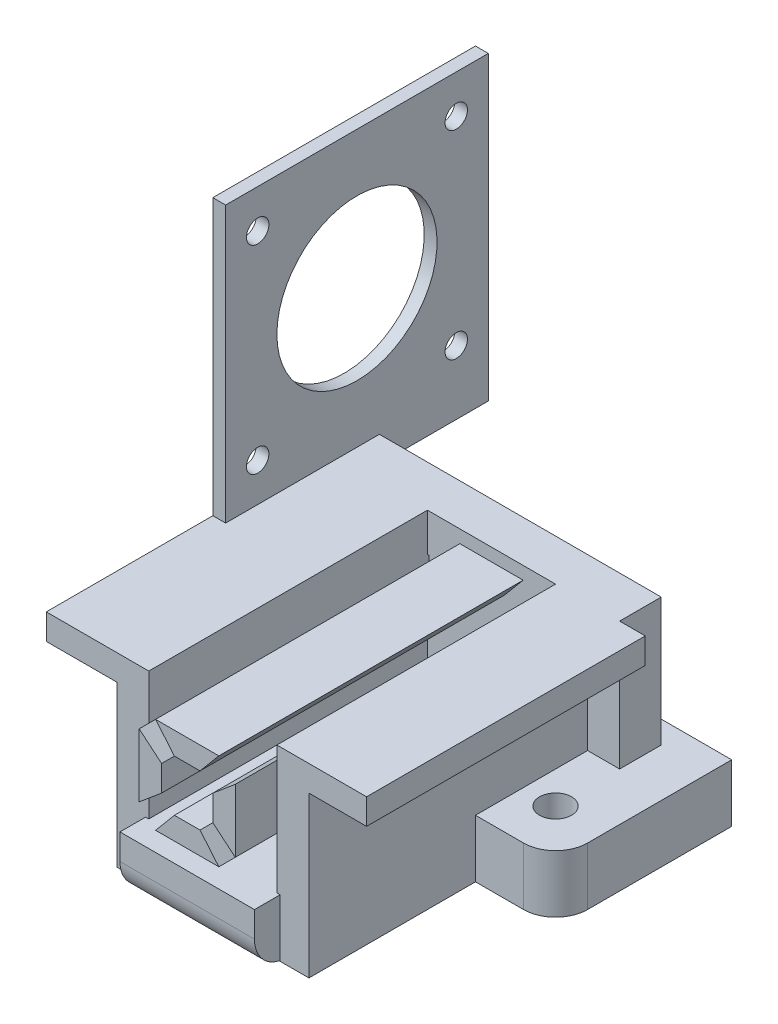
from build123d import *

# Parameters (mm, degrees)
BOSS_EXTRUDE2_DEPTH          = 8
BOSS_EXTRUDE2_DEPTH_BACK     = 1
SKETCH1_R                    = 2.5
CUT_EXTRUDE1_DEPTH           = 79.300702423
CUT_EXTRUDE1_DEPTH_BACK      = 79.300702423
SKETCH2_R                    = 2.5
SKETCH3_R                    = 3.25
CUT_EXTRUDE5_DEPTH           = 15
CUT_EXTRUDE5_DRAFT           = -0.0573
CUT_EXTRUDE5_PROFILE_2_DEPTH = 15
CUT_EXTRUDE5_PROFILE_2_DRAFT = -0.0573
SKETCH5_W                    = 9
SKETCH5_H                    = 6.5
BOSS_EXTRUDE3_DEPTH          = 14.5
CUT_EXTRUDE4_DEPTH           = 1.5
SKETCH12_W                   = 21
SKETCH12_H                   = 30
BOSS_EXTRUDE7_DEPTH          = 9
SKETCH15_W                   = 9
SKETCH15_H                   = 6.5
BOSS_EXTRUDE8_DEPTH          = 3.5
BOSS_EXTRUDE9_DEPTH          = 54
FILLET4_R                    = 5
SKETCH18_W                   = 9.873697418
SKETCH18_H                   = 6.5
BOSS_EXTRUDE11_DEPTH         = 0.5
SKETCH20_W                   = 4
SKETCH20_H                   = 17.5
BOSS_EXTRUDE12_DEPTH         = 18
BOSS_EXTRUDE13_DEPTH         = 11
BOSS_EXTRUDE13_DEPTH_BACK    = 4
SKETCH22_W                   = 17.5
SKETCH22_H                   = 4
SKETCH25_W                   = 2
SKETCH25_H                   = 17.5
BOSS_EXTRUDE14_DEPTH         = 41
SKETCH28_W                   = 41
SKETCH28_H                   = 45
BOSS_EXTRUDE15_DEPTH         = 2
SKETCH29_R                   = 1.75
CUT_EXTRUDE8_DEPTH           = 9
BOSS_EXTRUDE16_DEPTH         = 9
BOSS_EXTRUDE16_DEPTH_BACK    = 4
SKETCH30_W                   = 17.5
SKETCH30_H                   = 4
SKETCH31_R                   = 10
CUT_EXTRUDE9_DEPTH           = 9
SKETCH32_W                   = 13
SKETCH32_H                   = 4
BOSS_EXTRUDE17_DEPTH         = 23.5
SKETCH33_W                   = 0.5
SKETCH33_H                   = 17.5
BOSS_EXTRUDE18_DEPTH         = 20
BOSS_EXTRUDE19_DEPTH         = 26
SKETCH35_W                   = 9.873697418
SKETCH35_H                   = 0.5
BOSS_EXTRUDE20_DEPTH         = 47.5
BOSS_EXTRUDE21_DEPTH         = 47.5
SKETCH38_W                   = 0.419549816
SKETCH38_H                   = 18.5
CUT_EXTRUDE10_DEPTH          = 90.5
BOSS_EXTRUDE23_DEPTH         = 47.5
SKETCH46_W                   = 27.5
SKETCH46_H                   = 9
BOSS_EXTRUDE26_DEPTH         = 11.5
SKETCH47_W                   = 27.5
SKETCH47_H                   = 9
BOSS_EXTRUDE27_DEPTH         = 11
SKETCH48_W                   = 15.5
SKETCH48_H                   = 6.5
BOSS_EXTRUDE31_DEPTH         = 18.5
SKETCH50_R                   = 4
CUT_EXTRUDE11_DEPTH          = 1.5
SKETCH51_W                   = 9.626242636
SKETCH51_H                   = 9.125298808
BOSS_EXTRUDE32_DEPTH         = 1.5
SKETCH54_W                   = 8
SKETCH54_H                   = 8
BOSS_EXTRUDE35_DEPTH         = 47.5
SKETCH55_W                   = 9.873697418
SKETCH55_H                   = 0.5
CUT_EXTRUDE12_DEPTH          = 47.5
SKETCH56_W                   = 0.5
SKETCH56_H                   = 20
BOSS_EXTRUDE36_DEPTH         = 43.5
BOSS_EXTRUDE37_DEPTH         = 47.5
SKETCH58_W                   = 0.715052156
SKETCH58_H                   = 9.51279705
CUT_EXTRUDE13_DEPTH          = 4
CUT_EXTRUDE15_DEPTH          = 47.5
SKETCH60_W                   = 0.215052156
SKETCH60_H                   = 9.51279705
CUT_EXTRUDE16_DEPTH          = 47.5
CUT_EXTRUDE17_DEPTH          = 47.5
SKETCH62_W                   = 8
SKETCH62_H                   = 8
CUT_EXTRUDE18_DEPTH          = 47.5
SKETCH63_W                   = 13
SKETCH63_H                   = 4
CUT_EXTRUDE20_DEPTH          = 17
SKETCH64_W                   = 1
SKETCH64_H                   = 1.5
BOSS_EXTRUDE38_DEPTH         = 6.5
SKETCH65_W                   = 7
SKETCH65_H                   = 3
CUT_EXTRUDE21_DEPTH          = 1.5
BOSS_EXTRUDE39_START         = -2
SKETCH66_R                   = 10
BOSS_EXTRUDE39_DEPTH         = 2
SKETCH67_R                   = 12.5
CUT_EXTRUDE22_DEPTH          = 155
BOSS_EXTRUDE40_DEPTH         = 1.5
SKETCH70_W                   = 2
SKETCH70_H                   = 41
BOSS_EXTRUDE41_DEPTH         = 2


with BuildPart() as part:
    # Sketch1 → Boss-Extrude2 (new, two sides: drawn at the far end of the back side and taken through both)
    with BuildSketch(Plane(origin=(0, 0, 0), x_dir=(1, 0, 0), z_dir=(0, 1, 0)).offset(-BOSS_EXTRUDE2_DEPTH_BACK)):
        with BuildLine():
            Line((5, 0), (50, 0))
            ThreePointArc((50, 0), (53.535533906, 1.464466094), (55, 5))
            Line((55, 5), (55, 50))
            ThreePointArc((55, 50), (53.535533906, 53.535533906), (50, 55))
            Line((50, 55), (5, 55))
            ThreePointArc((5, 55), (1.464466094, 53.535533906), (0, 50))
            Line((0, 50), (0, 5))
            ThreePointArc((0, 5), (1.464466094, 1.464466094), (5, 0))
        make_face()
        with Locations((7.5, 47.5)):
            Circle(SKETCH1_R, mode=Mode.SUBTRACT)
        with Locations((47.5, 47.5)):
            Circle(SKETCH1_R, mode=Mode.SUBTRACT)
        with Locations((47.5, 7.5)):
            Circle(SKETCH1_R, mode=Mode.SUBTRACT)
        with Locations((7.5, 7.5)):
            Circle(SKETCH1_R, mode=Mode.SUBTRACT)
    extrude(amount=BOSS_EXTRUDE2_DEPTH + BOSS_EXTRUDE2_DEPTH_BACK)

    # Sketch2 → Cut-Extrude1 (cut, two sides: drawn at the far end of the back side and taken through both)
    with BuildSketch(Plane(origin=(0, 8, 0), x_dir=(1, 0, 0), z_dir=(0, 1, 0)).offset(-CUT_EXTRUDE1_DEPTH_BACK)):
        with BuildLine():
            Line((0, 50), (0, 27.5))
            Line((0, 27.5), (55, 27.5))
            Line((55, 27.5), (55, 50))
            ThreePointArc((55, 50), (53.535533906, 53.535533906), (50, 55))
            Line((50, 55), (5, 55))
            ThreePointArc((5, 55), (1.464466094, 53.535533906), (0, 50))
        make_face()
        with Locations((7.5, 47.5)):
            Circle(SKETCH2_R, mode=Mode.SUBTRACT)
        with Locations((47.5, 47.5)):
            Circle(SKETCH2_R, mode=Mode.SUBTRACT)
    extrude(amount=CUT_EXTRUDE1_DEPTH + CUT_EXTRUDE1_DEPTH_BACK, mode=Mode.SUBTRACT)


with BuildPart() as cut_extrude5_tool:
    # Sketch3 → Cut-Extrude5 (with draft: the straight prism first)
    with BuildSketch(Plane(origin=(0, 0, -27.5), x_dir=(-1, 0, 0), z_dir=(0, 0, -1))):
        with Locations((-37.5, 3.5)):
            Circle(SKETCH3_R)
    extrude(amount=-CUT_EXTRUDE5_DEPTH)
    # Cut-Extrude5: the draft: its side faces are tilted about the plane it starts from
    cut_extrude5_sides = [cut_extrude5_tool.faces().sort_by_distance(p)[0] for p in [
        (40.75, 3.5, -20),
    ]]
    draft(cut_extrude5_sides, Plane(origin=(0, 0, -27.5), x_dir=(-1, 0, 0), z_dir=(0, 0, -1)), CUT_EXTRUDE5_DRAFT)


with BuildPart() as part_1:
    add(part.part)

    # Cut-Extrude5: cut by cut_extrude5_tool
    add(cut_extrude5_tool.part, mode=Mode.SUBTRACT)


with BuildPart() as cut_extrude5_profile_2_tool:
    # Sketch3 → Cut-Extrude5 profile 2 (with draft: the straight prism first)
    with BuildSketch(Plane(origin=(0, 0, -27.5), x_dir=(-1, 0, 0), z_dir=(0, 0, -1))):
        with Locations((-17.5, 3.5)):
            Circle(SKETCH3_R)
    extrude(amount=-CUT_EXTRUDE5_PROFILE_2_DEPTH)
    # Cut-Extrude5 profile 2: the draft: its side faces are tilted about the plane it starts from
    cut_extrude5_profile_2_sides = [cut_extrude5_profile_2_tool.faces().sort_by_distance(p)[0] for p in [
        (20.75, 3.5, -20),
    ]]
    draft(cut_extrude5_profile_2_sides, Plane(origin=(0, 0, -27.5), x_dir=(-1, 0, 0), z_dir=(0, 0, -1)), CUT_EXTRUDE5_PROFILE_2_DRAFT)


with BuildPart() as part_2:
    add(part_1.part)

    # Cut-Extrude5 profile 2: cut by cut_extrude5_profile_2_tool
    add(cut_extrude5_profile_2_tool.part, mode=Mode.SUBTRACT)

    # Sketch5 → Boss-Extrude3 (add)
    with BuildSketch(Plane(origin=(0, 8, 0), x_dir=(1, 0, 0), z_dir=(0, 1, 0))):
        with Locations((27.5, 20.75)):
            Rectangle(SKETCH5_W, SKETCH5_H)
    extrude(amount=BOSS_EXTRUDE3_DEPTH)

    # Sketch6 → Cut-Extrude4 (cut)
    with BuildSketch(Plane(origin=(0, 0, -24), x_dir=(-1, 0, 0), z_dir=(0, 0, -1))):
        with BuildLine():
            ThreePointArc((-27.5, 13), (-24.671572875, 14.171572875), (-23.5, 17))
            ThreePointArc((-23.5, 17), (-30.328427125, 19.828427125), (-27.5, 13))
        make_face()
    extrude(amount=-CUT_EXTRUDE4_DEPTH, mode=Mode.SUBTRACT)

    # Sketch12 → Boss-Extrude7 (add)
    with BuildSketch(Plane(origin=(0, 8, 0), x_dir=(1, 0, 0), z_dir=(0, 1, 0))):
        with Locations((27.5, -15)):
            Rectangle(SKETCH12_W, SKETCH12_H)
    extrude(amount=-BOSS_EXTRUDE7_DEPTH)

    # Sketch15 → Boss-Extrude8 (add)
    with BuildSketch(Plane(origin=(0, 22.5, 0), x_dir=(1, 0, 0), z_dir=(0, 1, 0))):
        with Locations((27.5, 20.75)):
            Rectangle(SKETCH15_W, SKETCH15_H)
    extrude(amount=BOSS_EXTRUDE8_DEPTH)

    # Sketch11 → Boss-Extrude9 (add)
    with BuildSketch(Plane(origin=(0, 0, -24), x_dir=(-1, 0, 0), z_dir=(0, 0, -1))):
        Polygon((-29.5, 22.5), (-25.5, 22.5), (-22.563151291, 26), (-32.436848709, 26), align=None)
    extrude(amount=-BOSS_EXTRUDE9_DEPTH)

    # Fillet4
    fillet4_edges = [part_2.edges().sort_by_distance(p)[0] for p in [
        (27.5, -1, 30),
    ]]
    fillet(fillet4_edges, radius=FILLET4_R)

    # Sketch18 → Boss-Extrude11 (add)
    with BuildSketch(Plane(origin=(0, 26, 0), x_dir=(1, 0, 0), z_dir=(0, 1, 0))):
        with Locations((27.5, 20.75)):
            Rectangle(SKETCH18_W, SKETCH18_H)
    extrude(amount=BOSS_EXTRUDE11_DEPTH)

    # Sketch20 → Boss-Extrude12 (add)
    with BuildSketch(Plane(origin=(0, 8, 0), x_dir=(1, 0, 0), z_dir=(0, 1, 0))):
        with Locations((14.5, 8.75)):
            Rectangle(SKETCH20_W, SKETCH20_H)
        with Locations((40.5, 8.75)):
            Rectangle(SKETCH20_W, SKETCH20_H)
    extrude(amount=BOSS_EXTRUDE12_DEPTH)

    # Sketch22 → Boss-Extrude13 (add, two sides: drawn at the far end of the back side and taken through both)
    with BuildSketch(Plane.ZY.offset(-12.5).offset(-BOSS_EXTRUDE13_DEPTH_BACK)):
        with Locations((-8.75, 26)):
            Rectangle(SKETCH22_W, SKETCH22_H)
    extrude(amount=BOSS_EXTRUDE13_DEPTH + BOSS_EXTRUDE13_DEPTH_BACK)

    # Sketch25 → Boss-Extrude14 (add)
    with BuildSketch(Plane(origin=(0, 28, 0), x_dir=(1, 0, 0), z_dir=(0, 1, 0))):
        with Locations((2.5, 8.75)):
            Rectangle(SKETCH25_W, SKETCH25_H)
    extrude(amount=BOSS_EXTRUDE14_DEPTH)

    # Sketch28 → Boss-Extrude15 (add)
    with BuildSketch(Plane.ZY.offset(-1.5)):
        with Locations((-20.5, 46.5)):
            Rectangle(SKETCH28_W, SKETCH28_H)
    extrude(amount=-BOSS_EXTRUDE15_DEPTH)

    # Sketch29 → Cut-Extrude8 (cut)
    with BuildSketch(Plane.ZY.offset(-1.5)):
        with Locations((-5, 34)):
            Circle(SKETCH29_R)
        with Locations((-36, 34)):
            Circle(SKETCH29_R)
        with Locations((-36, 65)):
            Circle(SKETCH29_R)
        with Locations((-5, 65)):
            Circle(SKETCH29_R)
    extrude(amount=-CUT_EXTRUDE8_DEPTH, mode=Mode.SUBTRACT)

    # Sketch30 → Boss-Extrude16 (add, two sides: drawn at the far end of the back side and taken through both)
    with BuildSketch(Plane(origin=(42.5, 0, 0), x_dir=(0, 0, -1), z_dir=(1, 0, 0)).offset(-BOSS_EXTRUDE16_DEPTH_BACK)):
        with Locations((8.75, 26)):
            Rectangle(SKETCH30_W, SKETCH30_H)
    extrude(amount=BOSS_EXTRUDE16_DEPTH + BOSS_EXTRUDE16_DEPTH_BACK)

    # Sketch31 → Cut-Extrude9 (cut)
    with BuildSketch(Plane(origin=(3.5, 0, 0), x_dir=(0, 0, -1), z_dir=(1, 0, 0))):
        with Locations((20.5, 47)):
            Circle(SKETCH31_R)
    extrude(amount=-CUT_EXTRUDE9_DEPTH, mode=Mode.SUBTRACT)

    # Sketch32 → Boss-Extrude17 (add)
    with BuildSketch(Plane(origin=(0, 0, -17.5), x_dir=(-1, 0, 0), z_dir=(0, 0, -1))):
        with Locations((-10, 26)):
            Rectangle(SKETCH32_W, SKETCH32_H)
    extrude(amount=BOSS_EXTRUDE17_DEPTH)

    # Sketch33 → Boss-Extrude18 (add)
    with BuildSketch(Plane(origin=(0, 8, 0), x_dir=(1, 0, 0), z_dir=(0, 1, 0))):
        with Locations((38.25, 8.75)):
            Rectangle(SKETCH33_W, SKETCH33_H)
        with Locations((16.75, 8.75)):
            Rectangle(SKETCH33_W, SKETCH33_H)
    extrude(amount=BOSS_EXTRUDE18_DEPTH)

    # Sketch34 → Boss-Extrude19 (add)
    with BuildSketch(Plane.XY):
        Polygon((51.5, 24), (51.5, 28), (38, 28), (38, -1), (42.5, -1), (42.5, 24), align=None)
        Polygon((17, 28), (1.5, 28), (1.5, 24), (12.5, 24), (12.5, -1), (17, -1), align=None)
    extrude(amount=BOSS_EXTRUDE19_DEPTH)

    # Sketch35 → Boss-Extrude20 (add)
    with BuildSketch(Plane.XY.offset(-17.5)):
        with Locations((27.5, 26.25)):
            Rectangle(SKETCH35_W, SKETCH35_H)
    extrude(amount=BOSS_EXTRUDE20_DEPTH)

    # Sketch37 → Boss-Extrude21 (add)
    with BuildSketch(Plane.XY.offset(-17.5)):
        Polygon((29.5, 12), (25.5, 12), (21.863844179, 7.666598237), (33.136155821, 7.666598237), align=None)
    extrude(amount=BOSS_EXTRUDE21_DEPTH)

    # Sketch38 → Cut-Extrude10 (cut)
    with BuildSketch(Plane.XY.offset(30)):
        with Locations((22.353376383, 17.25)):
            Rectangle(SKETCH38_W, SKETCH38_H)
        with Locations((32.646623617, 17.25)):
            Rectangle(SKETCH38_W, SKETCH38_H)
    extrude(amount=-CUT_EXTRUDE10_DEPTH, mode=Mode.SUBTRACT)

    # Sketch39 → Boss-Extrude23 (add)
    with BuildSketch(Plane.XY.offset(30)):
        Polygon((38, 22.006398525), (37.284947844, 22.006398525), (34, 19.25), (34, 15.25), (37.284947844, 12.493601475), (38, 12.493601475), align=None)
        Polygon((21, 19.25), (17.715052156, 22.006398525), (17, 22.006398525), (17, 12.493601475), (17.715052156, 12.493601475), (21, 15.25), align=None)
    extrude(amount=-BOSS_EXTRUDE23_DEPTH)

    # Sketch46 → Boss-Extrude26 (add)
    with BuildSketch(Plane.ZY):
        with Locations((-13.75, 3.5)):
            Rectangle(SKETCH46_W, SKETCH46_H)
    extrude(amount=-BOSS_EXTRUDE26_DEPTH)

    # Sketch47 → Boss-Extrude27 (add)
    with BuildSketch(Plane.ZY):
        with Locations((-13.75, 3.5)):
            Rectangle(SKETCH47_W, SKETCH47_H)
    extrude(amount=BOSS_EXTRUDE27_DEPTH)

    # Sketch48 → Boss-Extrude31 (add)
    with BuildSketch(Plane(origin=(0, 8, 0), x_dir=(1, 0, 0), z_dir=(0, 1, 0))):
        with Locations((15.25, 20.75)):
            Rectangle(SKETCH48_W, SKETCH48_H)
        with Locations((39.75, 20.75)):
            Rectangle(SKETCH48_W, SKETCH48_H)
    extrude(amount=BOSS_EXTRUDE31_DEPTH)

    # Sketch50 → Cut-Extrude11 (cut)
    with BuildSketch(Plane(origin=(0, 0, -24), x_dir=(-1, 0, 0), z_dir=(0, 0, -1))):
        with Locations((-17.5, 17)):
            Circle(SKETCH50_R)
        with Locations((-37.5, 17)):
            Circle(SKETCH50_R)
    extrude(amount=-CUT_EXTRUDE11_DEPTH, mode=Mode.SUBTRACT)

    # Sketch51 → Boss-Extrude32 (add)
    with BuildSketch(Plane(origin=(0, 0, -24), x_dir=(-1, 0, 0), z_dir=(0, 0, -1))):
        with Locations((-27.646184708, 17.114099589)):
            Rectangle(SKETCH51_W, SKETCH51_H)
    extrude(amount=-BOSS_EXTRUDE32_DEPTH)

    # Sketch54 → Boss-Extrude35 (add)
    with BuildSketch(Plane.XY.offset(-17.5)):
        with Locations((27.5, 18.5)):
            Rectangle(SKETCH54_W, SKETCH54_H)
    extrude(amount=BOSS_EXTRUDE35_DEPTH)

    # Sketch55 → Cut-Extrude12 (cut)
    with BuildSketch(Plane.XY.offset(30)):
        with Locations((27.5, 26.25)):
            Rectangle(SKETCH55_W, SKETCH55_H)
    extrude(amount=-CUT_EXTRUDE12_DEPTH, mode=Mode.SUBTRACT)

    # Sketch56 → Boss-Extrude36 (add)
    with BuildSketch(Plane.XY.offset(26)):
        with Locations((37.75, 18)):
            Rectangle(SKETCH56_W, SKETCH56_H)
        with Locations((17.25, 18)):
            Rectangle(SKETCH56_W, SKETCH56_H)
    extrude(amount=-BOSS_EXTRUDE36_DEPTH)

    # Sketch57 → Boss-Extrude37 (add)
    with BuildSketch(Plane.XY.offset(30)):
        Polygon((35, 23.436848709), (31.5, 20.5), (31.5, 16.5), (35, 13.563151291), align=None)
        Polygon((20, 13.563151291), (23.5, 16.5), (23.5, 20.5), (20, 23.436848709), align=None)
        Polygon((32.436848709, 11), (29.5, 14.5), (25.5, 14.5), (22.563151291, 11), align=None)
    extrude(amount=-BOSS_EXTRUDE37_DEPTH)

    # Sketch58 → Cut-Extrude13 (cut)
    with BuildSketch(Plane.XY.offset(30)):
        with Locations((37.642473922, 17.25)):
            Rectangle(SKETCH58_W, SKETCH58_H)
        with Locations((17.357526078, 17.25)):
            Rectangle(SKETCH58_W, SKETCH58_H)
    extrude(amount=-CUT_EXTRUDE13_DEPTH, mode=Mode.SUBTRACT)

    # Sketch59 → Cut-Extrude15 (cut)
    with BuildSketch(Plane.XY.offset(30)):
        Polygon((37.284947844, 22.006398525), (35, 20.089099631), (35, 14.410900369), (37.284947844, 12.493601475), align=None)
        Polygon((17.715052156, 22.006398525), (20, 20.089099631), (20, 14.410900369), (17.715052156, 12.493601475), align=None)
    extrude(amount=-CUT_EXTRUDE15_DEPTH, mode=Mode.SUBTRACT)

    # Sketch60 → Cut-Extrude16 (cut)
    with BuildSketch(Plane.XY.offset(26)):
        with Locations((37.392473922, 17.25)):
            Rectangle(SKETCH60_W, SKETCH60_H)
        with Locations((17.607526078, 17.25)):
            Rectangle(SKETCH60_W, SKETCH60_H)
    extrude(amount=-CUT_EXTRUDE16_DEPTH, mode=Mode.SUBTRACT)

    # Sketch61 → Cut-Extrude17 (cut)
    with BuildSketch(Plane.XY.offset(30)):
        Polygon((32.436848709, 8), (22.563151291, 8), (22.563151291, 8.5), (24.660900369, 11), (30.339099631, 11), (32.436848709, 8.5), align=None)
    extrude(amount=-CUT_EXTRUDE17_DEPTH, mode=Mode.SUBTRACT)

    # Sketch62 → Cut-Extrude18 (cut)
    with BuildSketch(Plane.XY.offset(30)):
        with Locations((27.5, 18.5)):
            Rectangle(SKETCH62_W, SKETCH62_H)
    extrude(amount=-CUT_EXTRUDE18_DEPTH, mode=Mode.SUBTRACT)

    # Sketch63 → Cut-Extrude20 (cut)
    with BuildSketch(Plane(origin=(0, 0, -41), x_dir=(-1, 0, 0), z_dir=(0, 0, -1))):
        with Locations((-10, 26)):
            Rectangle(SKETCH63_W, SKETCH63_H)
    extrude(amount=-CUT_EXTRUDE20_DEPTH, mode=Mode.SUBTRACT)

    # Sketch64 → Boss-Extrude38 (add)
    with BuildSketch(Plane(origin=(0, 0, -17.5), x_dir=(-1, 0, 0), z_dir=(0, 0, -1))):
        with Locations((-17, 27.25)):
            Rectangle(SKETCH64_W, SKETCH64_H)
    extrude(amount=BOSS_EXTRUDE38_DEPTH)

    # Sketch65 → Cut-Extrude21 (cut)
    with BuildSketch(Plane(origin=(0, 28, 0), x_dir=(1, 0, 0), z_dir=(0, 1, 0))):
        with Locations((48, 16)):
            Rectangle(SKETCH65_W, SKETCH65_H)
    extrude(amount=-CUT_EXTRUDE21_DEPTH, mode=Mode.SUBTRACT)

    # Sketch66 → Boss-Extrude39 (add)
    with BuildSketch(Plane.ZY.offset(-1.5).offset(BOSS_EXTRUDE39_START)):
        with Locations((-20.5, 47)):
            Circle(SKETCH66_R)
    extrude(amount=BOSS_EXTRUDE39_DEPTH)

    # Sketch67 → Cut-Extrude22 (cut)
    with BuildSketch(Plane.ZY.offset(-1.5)):
        with Locations((-20.5, 49.5)):
            Circle(SKETCH67_R)
    extrude(amount=-CUT_EXTRUDE22_DEPTH, mode=Mode.SUBTRACT)

    # Sketch69 → Boss-Extrude40 (add)
    with BuildSketch(Plane(origin=(0, 26.5, 0), x_dir=(1, 0, 0), z_dir=(0, 1, 0))):
        Polygon((44.5, 14.5), (51.5, 14.5), (51.5, 17.5), (47.5, 17.5), (47.5, 24), (17.5, 24), (17.5, 17.5), (44.5, 17.5), align=None)
    extrude(amount=BOSS_EXTRUDE40_DEPTH)

    # Sketch70 → Boss-Extrude41 (add)
    with BuildSketch(Plane(origin=(0, 69, 0), x_dir=(1, 0, 0), z_dir=(0, 1, 0))):
        with Locations((2.5, 20.5)):
            Rectangle(SKETCH70_W, SKETCH70_H)
    extrude(amount=BOSS_EXTRUDE41_DEPTH)


solid = part_2.part
